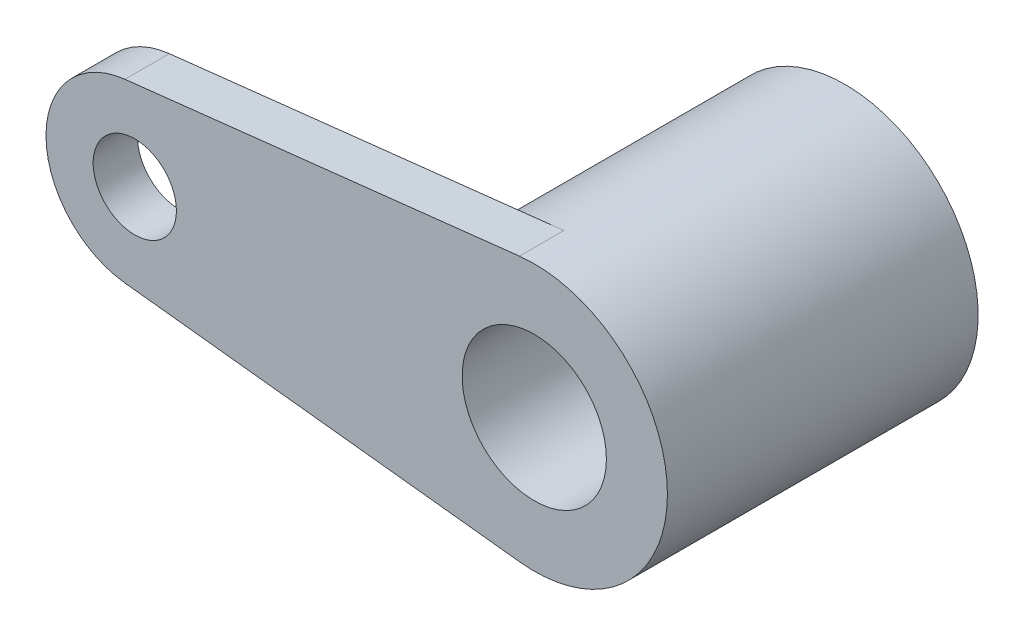
from build123d import *

# Parameters (mm, degrees)
BOSS_EXTRUDE1_DEPTH                                 = 12.7
CBORE_FOR_0_BINDING_HEAD_MACHINE_SCREW1_D           = 15.875
CBORE_FOR_0_BINDING_HEAD_MACHINE_SCREW1_CBORE_D     = 23.8252
CBORE_FOR_0_BINDING_HEAD_MACHINE_SCREW1_CBORE_DEPTH = 15.875
SKETCH9_R                                           = 20.6375
CUT_EXTRUDE2_DEPTH                                  = 146.358143907
SKETCH11_R                                          = 38.1
SKETCH11_R_2                                        = 20.6375
BOSS_EXTRUDE2_DEPTH                                 = 76.2


with BuildPart() as part:
    # Sketch1 → Boss-Extrude1 (new body)
    with BuildSketch(Plane.XY):
        with BuildLine():
            ThreePointArc((-117.122222222, 25.242722946), (-139.7, 0), (-117.122222222, -25.242722946))
            Line((-117.122222222, -25.242722946), (-4.233333333, -37.864084419))
            ThreePointArc((-4.233333333, -37.864084419), (38.1, 0), (-4.233333333, 37.864084419))
            Line((-4.233333333, 37.864084419), (-117.122222222, 25.242722946))
        make_face()
    extrude(amount=BOSS_EXTRUDE1_DEPTH)

    # CBORE for #0 Binding Head Machine Screw1 (through all)
    with Locations(Plane.XY.offset(12.7)):
        with Locations((-114.3, 0)):
            CounterBoreHole(CBORE_FOR_0_BINDING_HEAD_MACHINE_SCREW1_D / 2, CBORE_FOR_0_BINDING_HEAD_MACHINE_SCREW1_CBORE_D / 2, CBORE_FOR_0_BINDING_HEAD_MACHINE_SCREW1_CBORE_DEPTH)

    # Sketch9 → Cut-Extrude2 (cut, through all)
    with BuildSketch(Plane.XY.offset(12.7)):
        Circle(SKETCH9_R)
    extrude(amount=-CUT_EXTRUDE2_DEPTH, mode=Mode.SUBTRACT)

    # Sketch11 → Boss-Extrude2 (add)
    with BuildSketch(Plane(origin=(0, 0, 0), x_dir=(-1, 0, 0), z_dir=(0, 0, -1))):
        Circle(SKETCH11_R)
        with Locations(Location((0, 0, 0), (0, 0, 180))):
            Circle(SKETCH11_R_2, mode=Mode.SUBTRACT)
    extrude(amount=BOSS_EXTRUDE2_DEPTH)


solid = part.part
